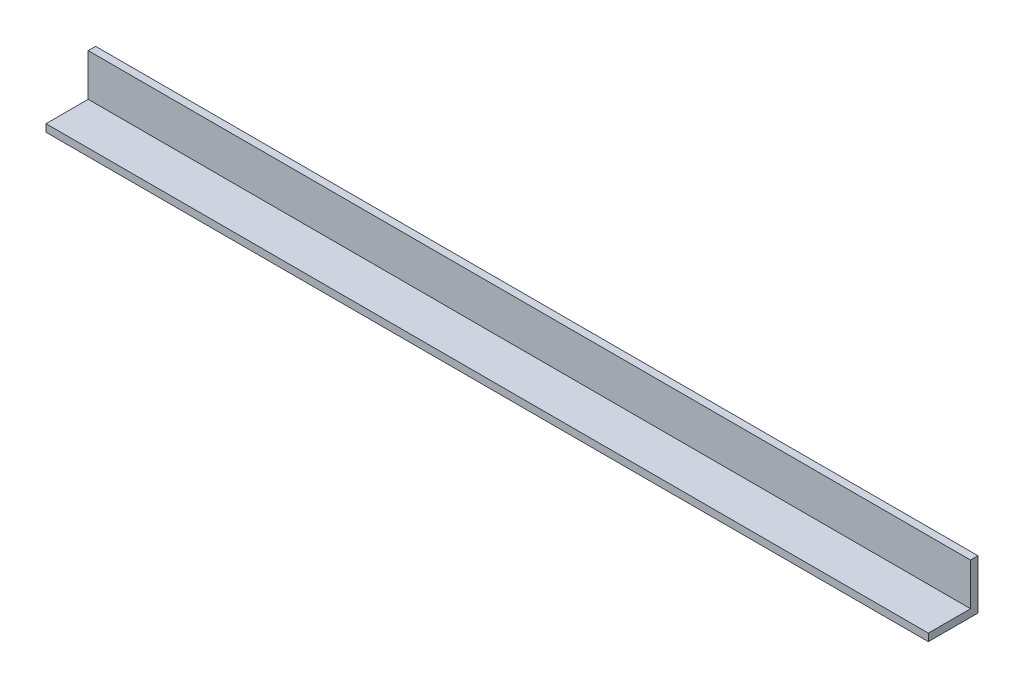
from build123d import *

# Parameters (mm, degrees)
SKETCH_1_W          = 1422
SKETCH_1_H          = 80
EXTRUDE_1_DEPTH     = 80
SKETCH_3_W          = 68
SKETCH_3_H          = 68
CUT_EXTRUDE_2_DEPTH = 1427.49360321


with BuildPart() as part:
    # 草图1 → 拉伸1 (new body)
    with BuildSketch(Plane.XY):
        with Locations((711, 40)):
            Rectangle(SKETCH_1_W, SKETCH_1_H)
    extrude(amount=EXTRUDE_1_DEPTH)

    # 草图3 → 拉伸2 (cut, through all)
    with BuildSketch(Plane.ZY):
        with Locations((46, 46)):
            Rectangle(SKETCH_3_W, SKETCH_3_H)
    extrude(amount=-CUT_EXTRUDE_2_DEPTH, mode=Mode.SUBTRACT)


solid = part.part
